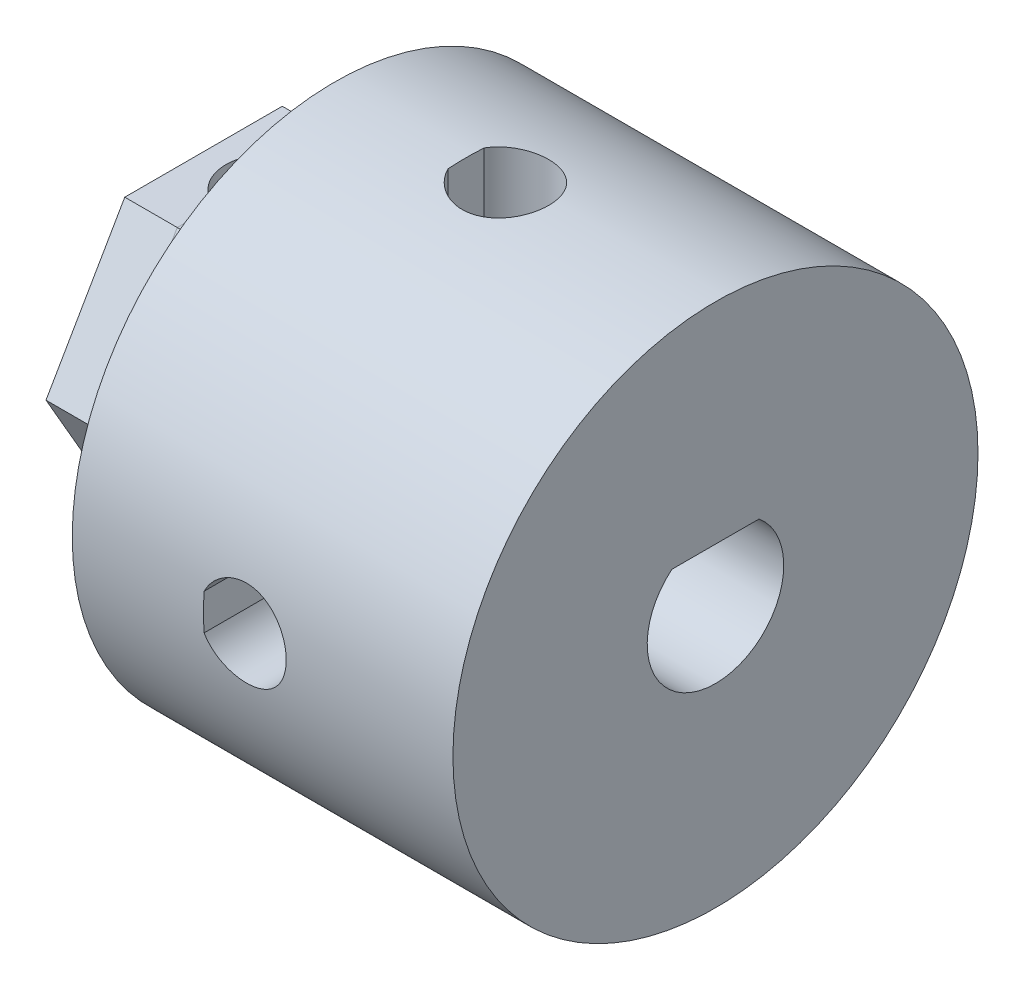
from build123d import *

# Parameters (mm, degrees)
SKETCH1_R               = 10
BOSS_EXTRUDE1_DEPTH     = 9.5
CUT_EXTRUDE3_DEPTH      = 25
CUT_EXTRUDE3_DEPTH_BACK = 25
SKETCH3_R               = 1.65
CUT_EXTRUDE4_DEPTH      = 25
CUT_EXTRUDE4_DEPTH_BACK = 25
SKETCH4_R               = 1.65
BOSS_EXTRUDE3_START     = 5
SKETCH6_R               = 10
BOSS_EXTRUDE3_DEPTH     = 5
CUT_EXTRUDE1_DEPTH      = 25
BOSS_EXTRUDE4_DEPTH     = 5
FILLET1_R               = 3
CUT_EXTRUDE5_DEPTH      = 100
CUT_EXTRUDE5_DEPTH_BACK = 100
SKETCH8_R               = 1.65


with BuildPart() as part:
    # Sketch1 → Boss-Extrude1 (new body)
    with BuildSketch(Plane(origin=(0, 0, 0), x_dir=(0, 0, -1), z_dir=(1, 0, 0))):
        Circle(SKETCH1_R)
    extrude(amount=BOSS_EXTRUDE1_DEPTH)

    # Sketch3 → Cut-Extrude3 (cut, two sides: drawn at the far end of the back side and taken through both)
    with BuildSketch(Plane(origin=(0, 0, 0), x_dir=(1, 0, 0), z_dir=(0, 1, 0)).offset(-CUT_EXTRUDE3_DEPTH_BACK)):
        with Locations((1.5, 0)):
            Circle(SKETCH3_R)
    extrude(amount=CUT_EXTRUDE3_DEPTH + CUT_EXTRUDE3_DEPTH_BACK, mode=Mode.SUBTRACT)

    # Sketch4 → Cut-Extrude4 (cut, two sides: drawn at the far end of the back side and taken through both)
    with BuildSketch(Plane.XY.offset(-CUT_EXTRUDE4_DEPTH_BACK)):
        with Locations((1.5, 0)):
            Circle(SKETCH4_R)
    extrude(amount=CUT_EXTRUDE4_DEPTH + CUT_EXTRUDE4_DEPTH_BACK, mode=Mode.SUBTRACT)

    # Sketch6 → Boss-Extrude3 (add)
    with BuildSketch(Plane.ZY.offset(BOSS_EXTRUDE3_START)):
        Circle(SKETCH6_R)
    extrude(amount=-BOSS_EXTRUDE3_DEPTH)

    # Sketch2 → Cut-Extrude1 (cut)
    with BuildSketch(Plane.ZY.offset(-9.5)):
        with BuildLine():
            ThreePointArc((2.6, 0), (2.353661446, 1.104661847), (1.661324773, 2))
            Line((1.661324773, 2), (-1.661324773, 2))
            ThreePointArc((-1.661324773, 2), (-1.104661847, -2.353661446), (2.6, 0))
        make_face()
    extrude(amount=CUT_EXTRUDE1_DEPTH, mode=Mode.SUBTRACT)

    # Sketch7 → Boss-Extrude4 (add)
    with BuildSketch(Plane.ZY.offset(5)):
        Polygon((-3, -5.196152423), (3, -5.196152423), (6, 0), (3, 5.196152423), (-3, 5.196152423), (-6, 0), align=None)
        Polygon((1.732050808, -3), (3.464101615, 0), (1.732050808, 3), (-1.732050808, 3), (-3.464101615, 0), (-1.732050808, -3), align=None, mode=Mode.SUBTRACT)
    extrude(amount=BOSS_EXTRUDE4_DEPTH)

    # Fillet1
    fillet1_edges = [part.edges().sort_by_distance(p)[0] for p in [
        (-5, -2.598076211, -4.5),
        (-5, -5.196152423, 0),
        (-5, -2.598076211, 4.5),
        (-5, 2.598076211, 4.5),
        (-5, 5.196152423, 0),
        (-5, 2.598076211, -4.5),
    ]]
    fillet(fillet1_edges, radius=FILLET1_R)

    # Sketch8 → Cut-Extrude5 (cut, two sides: drawn at the far end of the back side and taken through both)
    with BuildSketch(Plane(origin=(0, -5.196152423, 0), x_dir=(-1, 0, 0), z_dir=(0, -1, 0)).offset(-CUT_EXTRUDE5_DEPTH_BACK)):
        with Locations(Location((7.5, 0, 0), (0, 0, 287.639701394))):
            Circle(SKETCH8_R)
    extrude(amount=CUT_EXTRUDE5_DEPTH + CUT_EXTRUDE5_DEPTH_BACK, mode=Mode.SUBTRACT)


solid = part.part
